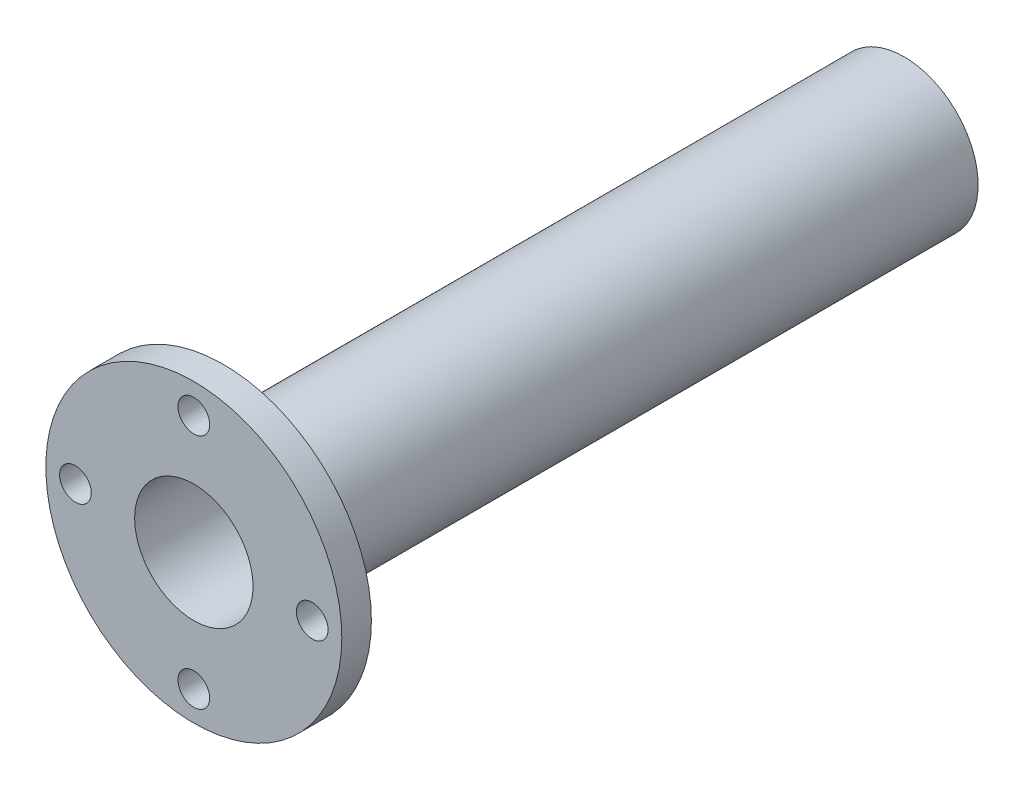
from build123d import *

# Parameters (mm, degrees)
SKETCH1_R                = 7.9375
SKETCH1_R_2              = 6.35
BOSS_EXTRUDE1_DEPTH      = 76.2
BOSS_EXTRUDE2_START      = -3.175
SKETCH2_R                = 15.875
SKETCH2_R_2              = 6.35
BOSS_EXTRUDE2_DEPTH      = 3.175
M3_CLEARANCE_HOLE1_D     = 3.4
M3_CLEARANCE_HOLE1_DEPTH = 4
M3_CLEARANCE_HOLE1_TIP   = 1.021463052


with BuildPart() as part:
    # Sketch1 → Boss-Extrude1 (new body)
    with BuildSketch(Plane.XY):
        with Locations(Location((0, 0, 0), (0, 0, 180))):
            Circle(SKETCH1_R)
        with Locations(Location((0, 0, 0), (0, 0, 180))):
            Circle(SKETCH1_R_2, mode=Mode.SUBTRACT)
    extrude(amount=BOSS_EXTRUDE1_DEPTH)

    # Sketch2 → Boss-Extrude2 (add)
    with BuildSketch(Plane.XY.offset(76.2).offset(BOSS_EXTRUDE2_START)):
        Circle(SKETCH2_R)
        with Locations(Location((0, 0, 0), (0, 0, 180))):
            Circle(SKETCH2_R_2, mode=Mode.SUBTRACT)
    extrude(amount=BOSS_EXTRUDE2_DEPTH)

    # M3 Clearance Hole1
    with Locations(Plane.XY.offset(76.2)):
        with Locations((0, 12.7), (0, -12.7), (12.7, 0), (-12.7, 0)):
            Hole(M3_CLEARANCE_HOLE1_D / 2, depth=M3_CLEARANCE_HOLE1_DEPTH)
            with Locations((0, 0, -(M3_CLEARANCE_HOLE1_DEPTH + M3_CLEARANCE_HOLE1_TIP / 2))):  # 118° drill point
                Cone(0, M3_CLEARANCE_HOLE1_D / 2, M3_CLEARANCE_HOLE1_TIP, mode=Mode.SUBTRACT)


solid = part.part
